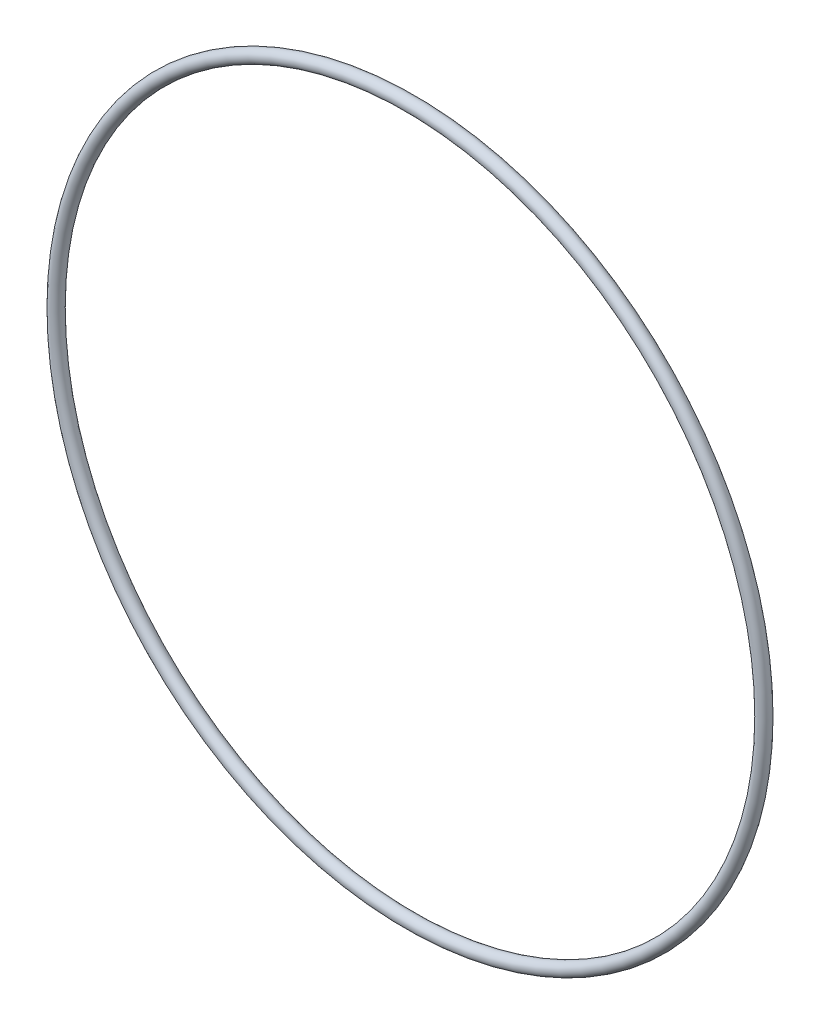
from build123d import *

# Parameters (mm, degrees)
SWEEP1_PROFILE_R = 0.8128


with BuildPart() as part:
    # Sweep1: sweep along a path in Sketch1
    with BuildLine(Plane.XY) as sweep1_path:
        CenterArc((0, 0), 44.5, 0, 360)
    # Sweep1 profile (on start of the path) → Sweep1 (sweep)
    with BuildSketch(Plane(origin=(44.5, 0, 0), x_dir=(0, 0, 1), z_dir=(0, 1, 0))):
        Circle(SWEEP1_PROFILE_R)
    sweep(path=sweep1_path.line)


solid = part.part
